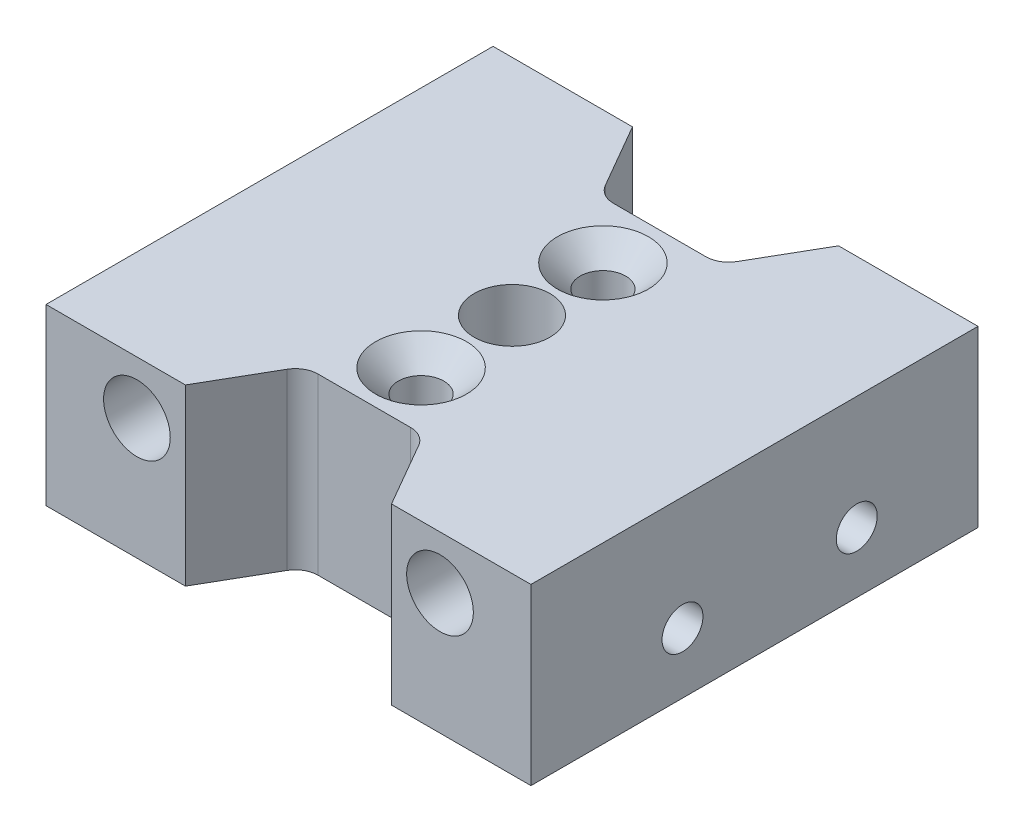
from build123d import *

# Parameters (mm, degrees)
SKETCH_1_W          = 31.99999989
SKETCH_1_H          = 11.5
SKETCH_1_R          = 2.2
EXTRUDE_1_DEPTH     = 29.5
SKETCH_2_R          = 2.5
CUT_EXTRUDE_1_DEPTH = 29.5
SKETCH_3_R          = 1.5
CUT_EXTRUDE_2_DEPTH = 29.5
CHAMFER_1_SIZE      = 1.5
SKETCH2_R           = 1.35
CUT_EXTRUDE1_DEPTH  = 10
EXTRUDE1_DEPTH      = 25


with BuildPart() as part:
    # 草图1 → 凸台-拉伸1 (new body)
    with BuildSketch(Plane.XY):
        with Locations((17.999999945, -43.99)):
            Rectangle(SKETCH_1_W, SKETCH_1_H)
        with Locations((8, -41.74)):
            Circle(SKETCH_1_R, mode=Mode.SUBTRACT)
        with Locations((27.99999989, -41.737899898)):
            Circle(SKETCH_1_R, mode=Mode.SUBTRACT)
    extrude(amount=EXTRUDE_1_DEPTH)

    # 草图2 → 切除-拉伸1 (cut)
    with BuildSketch(Plane.XZ.offset(49.74)):
        with Locations(Location((17.999999945, 14.75, 0), (0, 0, 270))):
            Circle(SKETCH_2_R)
    extrude(amount=-CUT_EXTRUDE_1_DEPTH, mode=Mode.SUBTRACT)

    # 草图3 → 切除-拉伸2 (cut)
    with BuildSketch(Plane.XZ.offset(49.74)):
        with Locations(Location((17.999999945, 8.75, 0), (0, 0, 270))):
            Circle(SKETCH_3_R)
        with Locations(Location((17.999999945, 20.75, 0), (0, 0, 270))):
            Circle(SKETCH_3_R)
    extrude(amount=-CUT_EXTRUDE_2_DEPTH, mode=Mode.SUBTRACT)

    # 倒角1
    chamfer_1_edges = [part.edges().sort_by_distance(p)[0] for p in [
        (17.999999945, -38.24, 10.25),
        (17.999999945, -38.24, 22.25),
    ]]
    chamfer(chamfer_1_edges, length=CHAMFER_1_SIZE)

    # Sketch2 → Cut-Extrude1 (cut)
    with BuildSketch(Plane(origin=(33.99999989, 0, 0), x_dir=(0, 0, -1), z_dir=(1, 0, 0))):
        with Locations((-19.5, -45.74)):
            Circle(SKETCH2_R)
        with Locations((-8, -45.74)):
            Circle(SKETCH2_R)
    cut_extrude1 = extrude(amount=-CUT_EXTRUDE1_DEPTH, mode=Mode.SUBTRACT)

    # Mirror1: Cut-Extrude1 across plane
    add(cut_extrude1.mirror(Plane.ZY.offset(-17.999999945)), mode=Mode.SUBTRACT)

    # Sketch3 → Extrude1 (cut)
    with BuildSketch(Plane(origin=(0, -38.24, 0), x_dir=(1, 0, 0), z_dir=(0, 1, 0))):
        with BuildLine():
            Line((11.2, 0), (13.653738644, -4.25))
            ThreePointArc((13.653738644, -4.25), (14.20277675, -4.799038106), (14.95277675, -5))
            Line((14.95277675, -5), (21.04722314, -5))
            ThreePointArc((21.04722314, -5), (21.79722314, -4.799038106), (22.346261246, -4.25))
            Line((22.346261246, -4.25), (24.79999989, 0))
            Line((24.79999989, 0), (11.2, 0))
        make_face()
        with BuildLine():
            Line((11.2, -29.5), (24.79999989, -29.5))
            Line((24.79999989, -29.5), (22.346261246, -25.25))
            ThreePointArc((22.346261246, -25.25), (21.79722314, -24.700961894), (21.04722314, -24.5))
            Line((21.04722314, -24.5), (14.95277675, -24.5))
            ThreePointArc((14.95277675, -24.5), (14.20277675, -24.700961894), (13.653738644, -25.25))
            Line((13.653738644, -25.25), (11.2, -29.5))
        make_face()
    extrude(amount=-EXTRUDE1_DEPTH, mode=Mode.SUBTRACT)


solid = part.part
